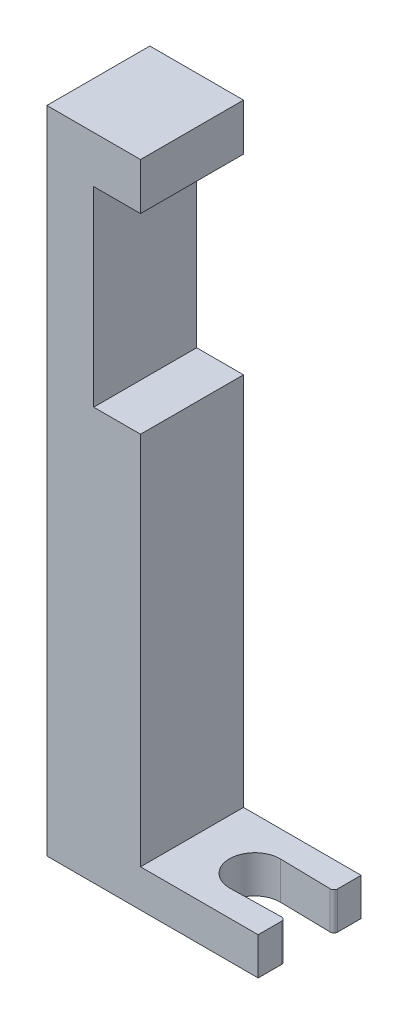
from build123d import *

# Parameters (mm, degrees)
SCREWHOOK_DEPTH        = 2.54
SPACERANDTOPHOOK_DEPTH = 6.980143326


with BuildPart() as part:
    # Sketch1 → ScrewHook (new body)
    with BuildSketch(Plane(origin=(0, 0, 0), x_dir=(1, 0, 0), z_dir=(0, 1, 0))):
        with BuildLine():
            Line((-5.624189629, 11.672719973), (-19.949200128, 11.672719973))
            Line((-19.949200128, 11.672719973), (-19.949200128, 18.652863299))
            Line((-19.949200128, 18.652863299), (-5.624189629, 18.652863299))
            Line((-5.624189629, 18.652863299), (-5.624189629, 17.065363299))
            ThreePointArc((-5.624189629, 17.065363299), (-5.700318254, 16.884041007), (-5.883069737, 16.811410184))
            Line((-5.883069737, 16.811410184), (-9.311436788, 16.877291636))
            ThreePointArc((-9.311436788, 16.877291636), (-11.059200128, 15.162791636), (-9.311436788, 13.448291636))
            Line((-9.311436788, 13.448291636), (-5.883069737, 13.514173088))
            ThreePointArc((-5.883069737, 13.514173088), (-5.700318254, 13.441542265), (-5.624189629, 13.260219973))
            Line((-5.624189629, 13.260219973), (-5.624189629, 11.672719973))
        make_face()
    extrude(amount=SCREWHOOK_DEPTH)

    # Sketch3 → SpacerAndTopHook (add)
    with BuildSketch(Plane.XY.offset(-11.672719973)):
        Polygon((-19.949200128, 2.54), (-19.949200128, 44.069), (-13.599200128, 44.069), (-13.599200128, 40.894), (-16.774200128, 40.894), (-16.774200128, 27.94), (-13.599200128, 27.94), (-13.599200128, 2.54), align=None)
    extrude(amount=-SPACERANDTOPHOOK_DEPTH)


solid = part.part
